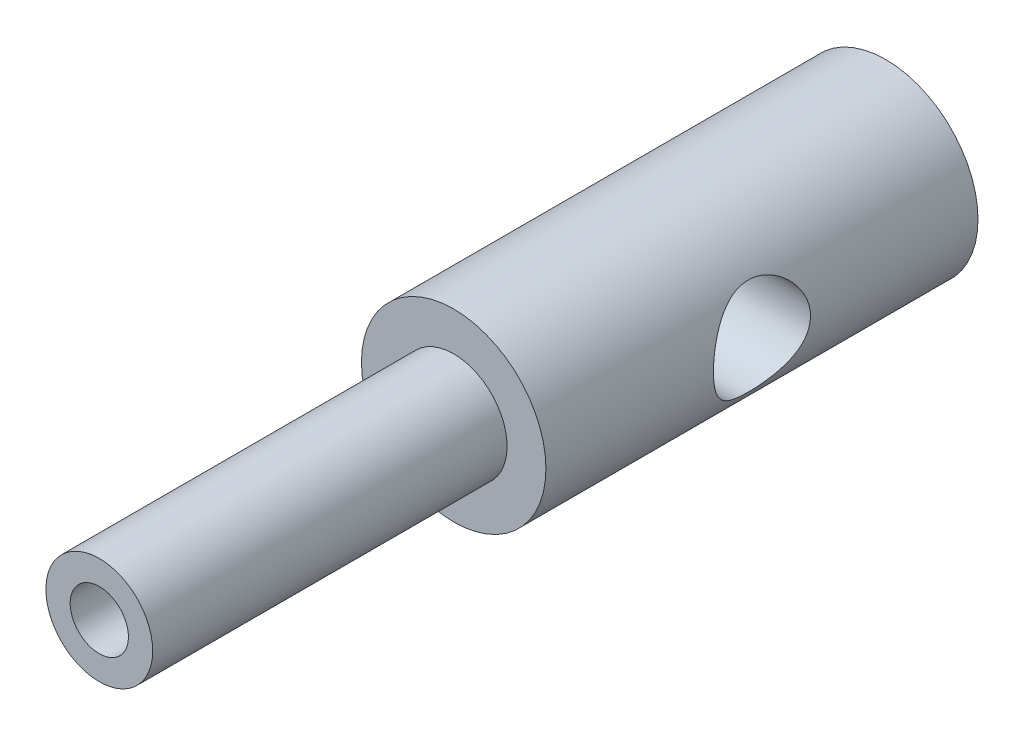
from build123d import *

# Parameters (mm, degrees)
CUT_EXTRUDE2_DEPTH      = 31.615430406
CUT_EXTRUDE2_DEPTH_BACK = 31.615430406
SKETCH2_R               = 2.54


with BuildPart() as part:
    # Sketch1 → Revolve1 (revolve)
    with BuildSketch(Plane(origin=(0, 0, 0), x_dir=(0, 0, -1), z_dir=(1, 0, 0)), mode=Mode.PRIVATE) as revolve1_sk:
        with BuildLine():
            Line((2.54, 0), (11.303, 0))
            Line((11.303, 0), (12.319, 0))
            ThreePointArc((12.319, 0), (12.085657597, 2.470822652), (11.303, 4.826))
            Line((11.303, 4.826), (-11.303, 4.826))
            Line((-11.303, 4.826), (-11.303, 2.794))
            Line((-11.303, 2.794), (-29.845, 2.794))
            Line((-29.845, 2.794), (-29.845, 1.524))
            Line((-29.845, 1.524), (-11.303, 1.524))
            Line((-11.303, 1.524), (-11.303, 0))
            Line((-11.303, 0), (-2.54, 0))
            ThreePointArc((-2.54, 0), (0, 2.54), (2.54, 0))
        make_face()
    revolve(revolve1_sk.sketch.rotate(Axis((0, 0, 36.613472311), (0, 0, -1)), 90), axis=Axis((0, 0, 36.613472311), (0, 0, -1)))

    # Sketch2 → Cut-Extrude2 (cut, two sides: drawn at the far end of the back side and taken through both)
    with BuildSketch(Plane(origin=(0, 0, 0), x_dir=(0, 0, -1), z_dir=(1, 0, 0)).offset(-CUT_EXTRUDE2_DEPTH_BACK)):
        Circle(SKETCH2_R)
    extrude(amount=CUT_EXTRUDE2_DEPTH + CUT_EXTRUDE2_DEPTH_BACK, mode=Mode.SUBTRACT)


solid = part.part
